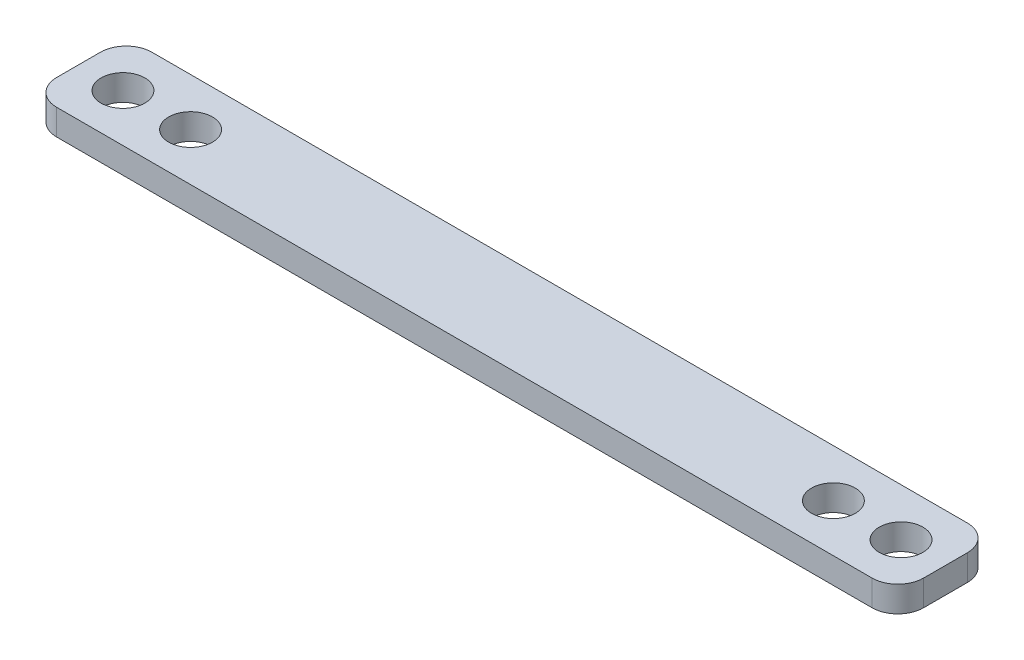
from build123d import *

# Parameters (mm, degrees)
SKETCH_1_W      = 67.3
SKETCH_1_H      = 7.4
SKETCH_1_R      = 1.7
EXTRUDE_1_DEPTH = 2
FILLET_1_R      = 2


with BuildPart() as part:
    # 草图1 → 凸台-拉伸1 (new body)
    with BuildSketch(Plane(origin=(0, 0, 0), x_dir=(1, 0, 0), z_dir=(0, 1, 0))):
        with Locations((0.193938282, 1.166796825)):
            Rectangle(SKETCH_1_W, SKETCH_1_H)
        with Locations(Location((-24.756061718, 1.166796825, 0), (0, 0, 270))):
            Circle(SKETCH_1_R, mode=Mode.SUBTRACT)
        with Locations(Location((25.143938282, 1.166796825, 0), (0, 0, 270))):
            Circle(SKETCH_1_R, mode=Mode.SUBTRACT)
        with Locations(Location((-30.006061718, 1.166796825, 0), (0, 0, 270))):
            Circle(SKETCH_1_R, mode=Mode.SUBTRACT)
        with Locations(Location((30.393938282, 1.166796825, 0), (0, 0, 270))):
            Circle(SKETCH_1_R, mode=Mode.SUBTRACT)
    extrude(amount=EXTRUDE_1_DEPTH)

    # 圆角1
    fillet_1_edges = [part.edges().sort_by_distance(p)[0] for p in [
        (33.843938282, 1, -4.866796825),
        (33.843938282, 1, 2.533203175),
        (-33.456061718, 1, 2.533203175),
        (-33.456061718, 1, -4.866796825),
    ]]
    fillet(fillet_1_edges, radius=FILLET_1_R)


solid = part.part
